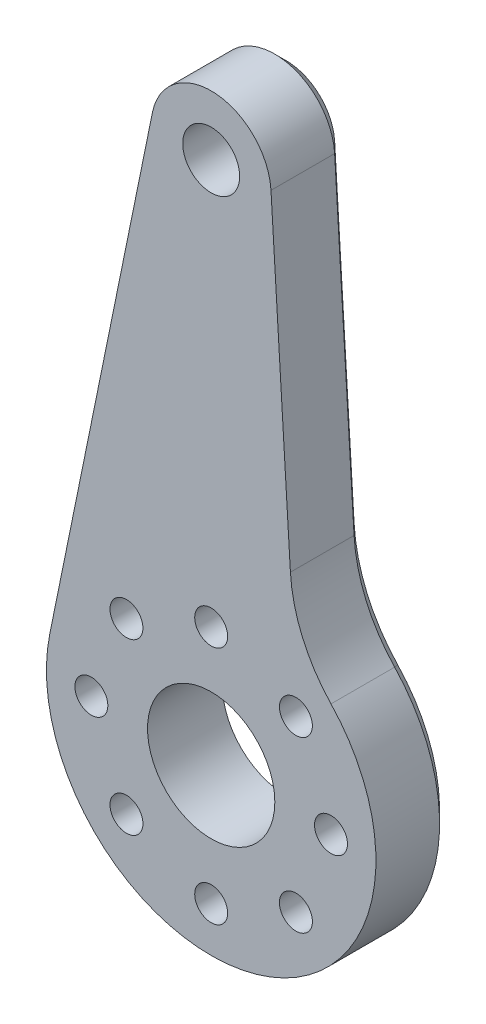
from build123d import *
from build123d.topology import SkipClean

# Parameters (mm, degrees)
SKETCH1_R             = 1.9
SKETCH1_R_2           = 4.25
SKETCH1_R_3           = 1.1
BOSS_EXTRUDE1_DEPTH   = 5
SKETCH4_R             = 1.75
CUT_EXTRUDE3_DEPTH    = 2.25
CORTAR_EXTRUIR1_DEPTH = 10
REDONDEO1_R           = 10
CHAFL_N1_SIZE         = 0.75


with BuildPart() as part:
    # Sketch1 → Boss-Extrude1 (new body)
    with BuildSketch(Plane.XY):
        with BuildLine():
            Line((-18.855049733, 15.176096398), (-25.713621013, -18.423903602))
            ThreePointArc((-25.713621013, -18.423903602), (-14.935866145, -31.623903602), (-4.158111277, -18.423903602))
            Line((-4.158111277, -18.423903602), (-11.016682556, 15.176096398))
            ThreePointArc((-11.016682556, 15.176096398), (-14.935866145, 18.376096398), (-18.855049733, 15.176096398))
        make_face()
        with Locations((-14.935866145, 14.376096398)):
            Circle(SKETCH1_R, mode=Mode.SUBTRACT)
        with Locations((-14.935866145, -20.623903602)):
            Circle(SKETCH1_R_2, mode=Mode.SUBTRACT)
        with Locations((-6.935866145, -20.623903602)):
            Circle(SKETCH1_R_3, mode=Mode.SUBTRACT)
        with Locations((-9.279011895, -26.280757851)):
            Circle(SKETCH1_R_3, mode=Mode.SUBTRACT)
        with Locations((-14.935866145, -28.623903602)):
            Circle(SKETCH1_R_3, mode=Mode.SUBTRACT)
        with Locations((-20.592720394, -26.280757851)):
            Circle(SKETCH1_R_3, mode=Mode.SUBTRACT)
        with Locations((-22.935866145, -20.623903602)):
            Circle(SKETCH1_R_3, mode=Mode.SUBTRACT)
        with Locations((-20.592720394, -14.967049352)):
            Circle(SKETCH1_R_3, mode=Mode.SUBTRACT)
        with Locations((-14.935866145, -12.623903602)):
            Circle(SKETCH1_R_3, mode=Mode.SUBTRACT)
        with Locations((-9.279011895, -14.967049352)):
            Circle(SKETCH1_R_3, mode=Mode.SUBTRACT)
    extrude(amount=BOSS_EXTRUDE1_DEPTH)

    # Sketch4 → Cut-Extrude3 (cut)
    with BuildSketch(Plane(origin=(0, 0, 0), x_dir=(-1, 0, 0), z_dir=(0, 0, -1))):
        with Locations((22.935866145, -20.623903602)):
            Circle(SKETCH4_R)
        with Locations((20.592720394, -26.280757851)):
            Circle(SKETCH4_R)
        with Locations((14.935866145, -28.623903602)):
            Circle(SKETCH4_R)
        with Locations((9.279011895, -26.280757851)):
            Circle(SKETCH4_R)
        with Locations((6.935866145, -20.623903602)):
            Circle(SKETCH4_R)
        with Locations((9.279011895, -14.967049352)):
            Circle(SKETCH4_R)
        with Locations((14.935866145, -12.623903602)):
            Circle(SKETCH4_R)
        with Locations((20.592720394, -14.967049352)):
            Circle(SKETCH4_R)
    extrude(amount=-CUT_EXTRUDE3_DEPTH, mode=Mode.SUBTRACT)

    # Croquis1 → Cortar-Extruir1 (cut)
    with SkipClean():  # the faces are left unmerged after this step: merging them gives an invalid solid
        with BuildSketch(Plane(origin=(0, 0, 0), x_dir=(-1, 0, 0), z_dir=(0, 0, -1))):
            with BuildLine():
                Line((10.943170263, 14.617715091), (9.385221653, -11.127043819))
                ThreePointArc((9.385221653, -11.127043819), (5.993539989, -14.21806229), (4.158111277, -18.423903602))
                Line((4.158111277, -18.423903602), (11.016682556, 15.176096398))
                ThreePointArc((11.016682556, 15.176096398), (10.970086699, 14.898201167), (10.943170263, 14.617715091))
            make_face()
        extrude(amount=-CORTAR_EXTRUIR1_DEPTH, mode=Mode.SUBTRACT)

    # Redondeo1
    redondeo1_edges = [part.edges().sort_by_distance(p)[0] for p in [
        (-9.385221653, -11.127043819, 2.5),
    ]]
    fillet(redondeo1_edges, radius=REDONDEO1_R)

    # Chaflán1
    chafl_n1_edges = [part.edges().sort_by_distance(p)[0] for p in [
        (-10.294724055, 3.902283801, 0),
        (-8.841725264, -10.181409474, 0),
        (-14.935866145, -31.623903602, 0),
        (-22.284335373, -1.623903602, 0),
        (-14.935866145, 18.376096398, 0),
    ]]
    chamfer(chafl_n1_edges, length=CHAFL_N1_SIZE)


solid = part.part
